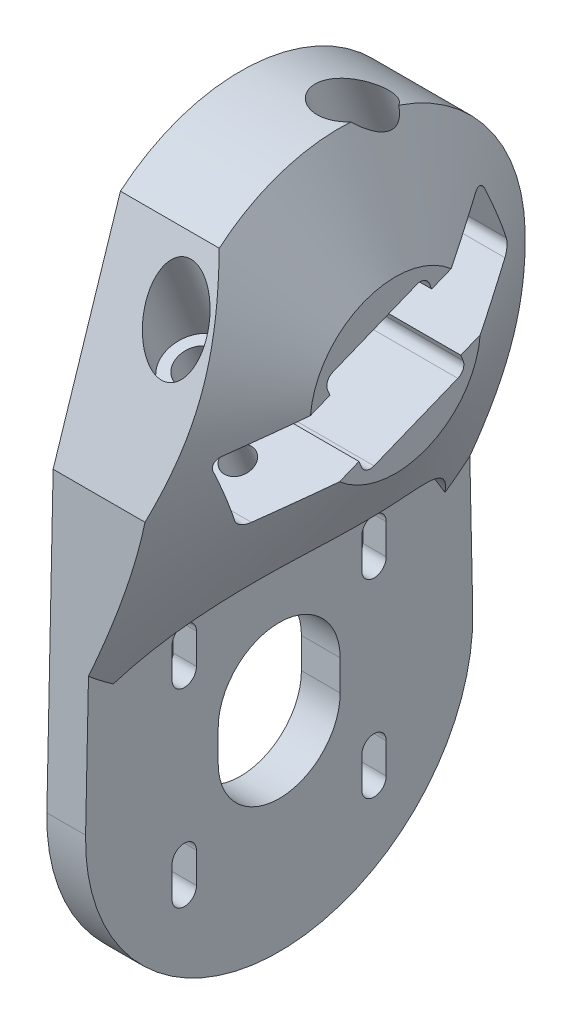
from build123d import *

# Parameters (mm, degrees)
BOSS_EXTRUDE1_DEPTH = 6.35
CUT_EXTRUDE18_DEPTH = 10
SKETCH20_R          = 57.15
BOSS_EXTRUDE5_DEPTH = 19.05
CUT_EXTRUDE14_DEPTH = 111.748555295
SKETCH22_R          = 3.175
CUT_EXTRUDE15_DEPTH = 117.849102749
SKETCH24_R          = 5
CUT_EXTRUDE16_DEPTH = 122.747909556
SKETCH25_R          = 2.38125
CUT_EXTRUDE17_DEPTH = 10
CHAMFER2_SIZE       = 2.5
FILLET1_R           = 1.5875
SKETCH28_R          = 31
CUT_EXTRUDE19_DEPTH = 110.466821527
CUT_EXTRUDE20_DEPTH = 106.059501871
CUT_EXTRUDE21_DEPTH = 101.035906079


with BuildPart() as part:
    # Sketch1 → Boss-Extrude1 (new body)
    with BuildSketch(Plane(origin=(0, 0, 0), x_dir=(0, 0, -1), z_dir=(1, 0, 0))):
        with BuildLine():
            Line((-30.473090912, 0.648945516), (-31.742803033, -58.974015088))
            ThreePointArc((-31.742803033, -58.974015088), (0, -91.4), (31.742803033, -58.974015088))
            Line((31.742803033, -58.974015088), (30.473090912, 0.648945516))
            ThreePointArc((30.473090912, 0.648945516), (0, 30.48), (-30.473090912, 0.648945516))
        make_face()
        Polygon((4.97319535, 11.716114032), (-11.716114032, 4.97319535), (-4.97319535, -11.716114032), (11.716114032, -4.97319535), align=None, mode=Mode.SUBTRACT)
    extrude(amount=BOSS_EXTRUDE1_DEPTH)

    # Sketch19 → Cut-Extrude18 (cut)
    with BuildSketch(Plane(origin=(6.35, 0, 0), x_dir=(0, 0, -1), z_dir=(1, 0, 0))):
        with BuildLine():
            Line((13.556349186, -39.093650814), (13.556349186, -44.093650814))
            ThreePointArc((13.556349186, -44.093650814), (15.556349186, -46.093650814), (17.556349186, -44.093650814))
            Line((17.556349186, -44.093650814), (17.556349186, -39.093650814))
            ThreePointArc((17.556349186, -39.093650814), (15.556349186, -37.093650814), (13.556349186, -39.093650814))
        make_face()
        with BuildLine():
            Line((-10, -54.65), (-10, -59.65))
            ThreePointArc((-10, -59.65), (0, -69.65), (10, -59.65))
            Line((10, -59.65), (10, -54.65))
            ThreePointArc((10, -54.65), (0, -44.65), (-10, -54.65))
        make_face()
        with BuildLine():
            Line((17.556349186, -75.206349186), (17.556349186, -70.206349186))
            ThreePointArc((17.556349186, -70.206349186), (15.556349186, -68.206349186), (13.556349186, -70.206349186))
            Line((13.556349186, -70.206349186), (13.556349186, -75.206349186))
            ThreePointArc((13.556349186, -75.206349186), (15.556349186, -77.206349186), (17.556349186, -75.206349186))
        make_face()
        with BuildLine():
            Line((-17.556349186, -39.093650814), (-17.556349186, -44.093650814))
            ThreePointArc((-17.556349186, -44.093650814), (-15.556349186, -46.093650814), (-13.556349186, -44.093650814))
            Line((-13.556349186, -44.093650814), (-13.556349186, -39.093650814))
            ThreePointArc((-13.556349186, -39.093650814), (-15.556349186, -37.093650814), (-17.556349186, -39.093650814))
        make_face()
        with BuildLine():
            Line((-13.556349186, -75.206349186), (-13.556349186, -70.206349186))
            ThreePointArc((-13.556349186, -70.206349186), (-15.556349186, -68.206349186), (-17.556349186, -70.206349186))
            Line((-17.556349186, -70.206349186), (-17.556349186, -75.206349186))
            ThreePointArc((-17.556349186, -75.206349186), (-15.556349186, -77.206349186), (-13.556349186, -75.206349186))
        make_face()
    extrude(amount=-CUT_EXTRUDE18_DEPTH, mode=Mode.SUBTRACT)

    # Sketch20 → Boss-Extrude5 (add)
    with BuildSketch(Plane(origin=(6.35, 0, 0), x_dir=(0, 0, -1), z_dir=(1, 0, 0))):
        with Locations(Location((0, 0, 0), (0, 0, 236.549078571))):
            Circle(SKETCH20_R)
    extrude(amount=BOSS_EXTRUDE5_DEPTH)

    # Sketch21 → Cut-Extrude14 (cut, through all)
    with BuildSketch(Plane.ZY):
        Polygon((-19.873660641, 14.878175718), (-24.631164378, 3.102940765), (-10.723406559, -2.516158136), (-5.965902823, 9.259076817), align=None)
        Polygon((-11.716114032, -4.97319535), (-4.97319535, 11.716114032), (11.716114032, 4.97319535), (4.97319535, -11.716114032), align=None)
        Polygon((10.723406559, 2.516158136), (5.965902823, -9.259076817), (19.873660641, -14.878175718), (24.631164378, -3.102940765), align=None)
    extrude(amount=-CUT_EXTRUDE14_DEPTH, mode=Mode.SUBTRACT)

    # Sketch22 → Cut-Extrude15 (cut, through all)
    with BuildSketch(Plane(origin=(0, 5.887617476, 2.378751868), x_dir=(1, 0, 0), z_dir=(0, -0.9271838545667871, -0.3746065934159129))):
        with Locations(Location((12.5, 16.5, 0), (0, 0, 270))):
            Circle(SKETCH22_R)
    cut_extrude15 = extrude(amount=-CUT_EXTRUDE15_DEPTH, mode=Mode.SUBTRACT)

    # Sketch24 → Cut-Extrude16 (cut, through all)
    with BuildSketch(Plane(origin=(0, 10.597711458, 4.281753363), x_dir=(1, 0, 0), z_dir=(0, -0.9271838545667871, -0.3746065934159129))):
        with Locations(Location((12.5, 16.5, 0), (0, 0, 270))):
            Circle(SKETCH24_R)
    cut_extrude16 = extrude(amount=-CUT_EXTRUDE16_DEPTH, mode=Mode.SUBTRACT)

    # Sketch25 → Cut-Extrude17 (cut)
    with BuildSketch(Plane(origin=(0, -5.887617476, -2.378751868), x_dir=(-1, 0, 0), z_dir=(0, 0.9271838545667864, 0.3746065934159146))):
        with Locations(Location((-12.5, 16.5, 0), (0, 0, 90))):
            Circle(SKETCH25_R)
    cut_extrude17 = extrude(amount=-CUT_EXTRUDE17_DEPTH, mode=Mode.SUBTRACT)

    # Mirror1: Cut-Extrude15, Cut-Extrude16, Cut-Extrude17 across plane
    add(cut_extrude15.mirror(Plane(origin=(0, 0, 0), x_dir=(1, 0, 0), z_dir=(0, 0.37460659341591346, -0.9271838545667869))), mode=Mode.SUBTRACT)
    add(cut_extrude16.mirror(Plane(origin=(0, 0, 0), x_dir=(1, 0, 0), z_dir=(0, 0.37460659341591346, -0.9271838545667869))), mode=Mode.SUBTRACT)
    add(cut_extrude17.mirror(Plane(origin=(0, 0, 0), x_dir=(1, 0, 0), z_dir=(0, 0.37460659341591346, -0.9271838545667869))), mode=Mode.SUBTRACT)


with BuildPart() as body_2:
    # Mirror2: mirrored copy
    add(part.part.mirror(Plane(origin=(0, 0, 0), x_dir=(0, 0, 1), z_dir=(1, 0, 0))))


with BuildPart() as part_1:
    add(part.part)

    # Chamfer2
    chamfer2_edges = [part_1.edges().sort_by_distance(p)[0] for p in [
        (0, -41.593650814, 13.556349186),
        (0, -37.093650814, 15.556349186),
        (0, -41.593650814, 17.556349186),
        (0, -46.093650814, 15.556349186),
        (0, -41.593650814, -17.556349186),
        (0, -37.093650814, -15.556349186),
        (0, -41.593650814, -13.556349186),
        (0, -46.093650814, -15.556349186),
    ]]
    chamfer(chamfer2_edges, length=CHAMFER2_SIZE)

    # Fillet1
    fillet1_edges = [part_1.edges().sort_by_distance(p)[0] for p in [
        (12.7, 3.102940765, -24.631164378),
        (12.7, 14.878175718, -19.873660641),
        (12.7, -3.102940765, 24.631164378),
        (12.7, -14.878175718, 19.873660641),
        (12.7, 11.716114032, -4.97319535),
        (12.7, 4.97319535, 11.716114032),
        (12.7, -11.716114032, 4.97319535),
        (12.7, -4.97319535, -11.716114032),
    ]]
    fillet(fillet1_edges, radius=FILLET1_R)

    # Sketch28 → Cut-Extrude19 (cut, through all)
    with BuildSketch(Plane(origin=(6.35, 0, 0), x_dir=(0, 0, -1), z_dir=(1, 0, 0))):
        with Locations((0, -54.65)):
            Circle(SKETCH28_R)
    extrude(amount=CUT_EXTRUDE19_DEPTH, mode=Mode.SUBTRACT)

    # Sketch31 → Cut-Revolve1 (revolve, cut)
    with BuildSketch(Plane(origin=(0, 0, 0), x_dir=(1, 0, 0), z_dir=(0, 1, 0)), mode=Mode.PRIVATE) as cut_revolve1_sk:
        Polygon((6.35, -58.97), (25.4, -58.97), (25.4, -13.97), (6.35, -48.172984338), align=None)
    revolve(cut_revolve1_sk.sketch.rotate(Axis((25.4, 0, 0), (-1, 0, 0)), 5.035691801), axis=Axis((25.4, 0, 0), (-1, 0, 0)), mode=Mode.SUBTRACT)

    # Sketch32 → Cut-Extrude20 (cut, through all)
    with BuildSketch(Plane.ZY.offset(-6.35)):
        with BuildLine():
            Line((30.473090912, 0.648945516), (31.267330303, -36.646834457))
            ThreePointArc((31.267330303, -36.646834457), (0, 48.172984338), (-31.267330303, -36.646834457))
            Line((-31.267330303, -36.646834457), (-30.473090912, 0.648945516))
            ThreePointArc((-30.473090912, 0.648945516), (0, 30.48), (30.473090912, 0.648945516))
        make_face()
    extrude(amount=-CUT_EXTRUDE20_DEPTH, mode=Mode.SUBTRACT)

    # Sketch33 → Cut-Extrude21 (cut, through all)
    with BuildSketch(Plane.ZY):
        with BuildLine():
            Line((30.714553642, -10.689626936), (30.473090912, 0.648945516))
            ThreePointArc((30.473090912, 0.648945516), (27.509849022, 13.123970694), (19.678291434, 23.276495575))
            Line((19.678291434, 23.276495575), (30.714553642, -10.689626936))
        make_face()
    extrude(amount=-CUT_EXTRUDE21_DEPTH, mode=Mode.SUBTRACT)


solid = part_1.part
